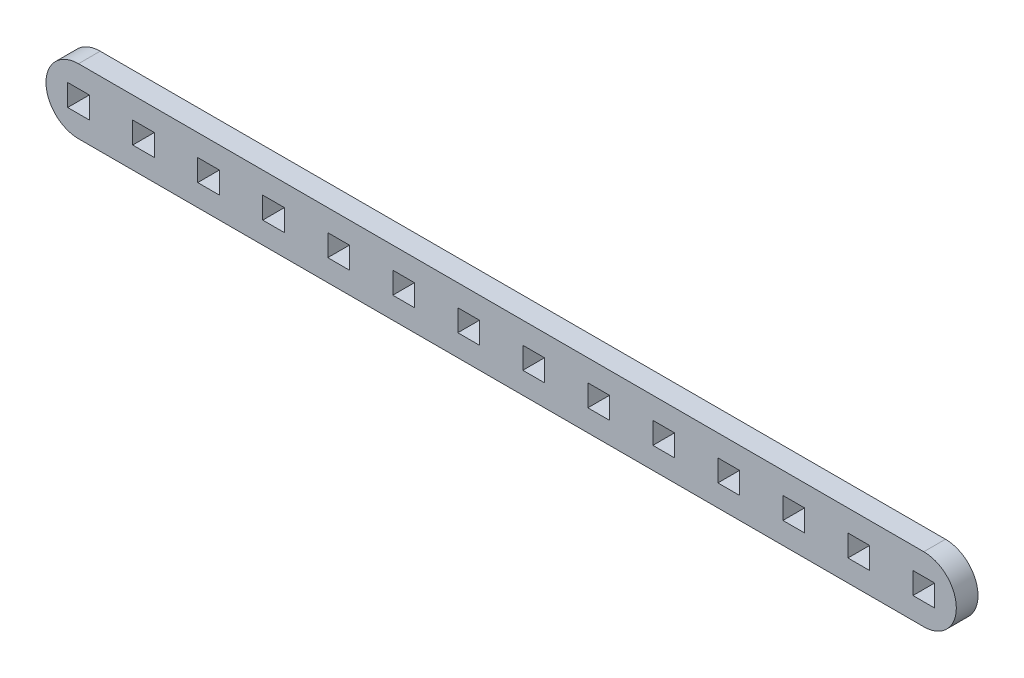
from build123d import *

# Parameters (mm, degrees)
MODEL_W                 = 3
MODEL_H                 = 3
SALIENTE_EXTRUIR1_DEPTH = 3


with BuildPart() as part:
    # Model → Saliente-Extruir1 (new body)
    with BuildSketch(Plane.XY):
        with BuildLine():
            Line((9.904781567, 296.774995526), (126.904781567, 296.774995526))
            ThreePointArc((126.904781567, 296.774995526), (131.404781567, 292.274995526), (126.904781567, 287.774995526))
            Line((126.904781567, 287.774995526), (9.904781567, 287.774995526))
            ThreePointArc((9.904781567, 287.774995526), (5.404781567, 292.274995526), (9.904781567, 296.774995526))
        make_face()
        with Locations((9.904781567, 292.274995526)):
            Rectangle(MODEL_W, MODEL_H, mode=Mode.SUBTRACT)
        with Locations((18.904781567, 292.274995526)):
            Rectangle(MODEL_W, MODEL_H, mode=Mode.SUBTRACT)
        with Locations((27.904781567, 292.274995526)):
            Rectangle(MODEL_W, MODEL_H, mode=Mode.SUBTRACT)
        with Locations((36.904781567, 292.274995526)):
            Rectangle(MODEL_W, MODEL_H, mode=Mode.SUBTRACT)
        with Locations((45.904781567, 292.274995526)):
            Rectangle(MODEL_W, MODEL_H, mode=Mode.SUBTRACT)
        with Locations((54.904781567, 292.274995526)):
            Rectangle(MODEL_W, MODEL_H, mode=Mode.SUBTRACT)
        with Locations((63.904781567, 292.274995526)):
            Rectangle(MODEL_W, MODEL_H, mode=Mode.SUBTRACT)
        with Locations((72.904781567, 292.274995526)):
            Rectangle(MODEL_W, MODEL_H, mode=Mode.SUBTRACT)
        with Locations((81.904781567, 292.274995526)):
            Rectangle(MODEL_W, MODEL_H, mode=Mode.SUBTRACT)
        with Locations((90.904781567, 292.274995526)):
            Rectangle(MODEL_W, MODEL_H, mode=Mode.SUBTRACT)
        with Locations((126.904781567, 292.274995526)):
            Rectangle(MODEL_W, MODEL_H, mode=Mode.SUBTRACT)
        with Locations((99.904781567, 292.274995526)):
            Rectangle(MODEL_W, MODEL_H, mode=Mode.SUBTRACT)
        with Locations((108.904781567, 292.274995526)):
            Rectangle(MODEL_W, MODEL_H, mode=Mode.SUBTRACT)
        with Locations((117.904781567, 292.274995526)):
            Rectangle(MODEL_W, MODEL_H, mode=Mode.SUBTRACT)
    extrude(amount=SALIENTE_EXTRUIR1_DEPTH)


solid = part.part
